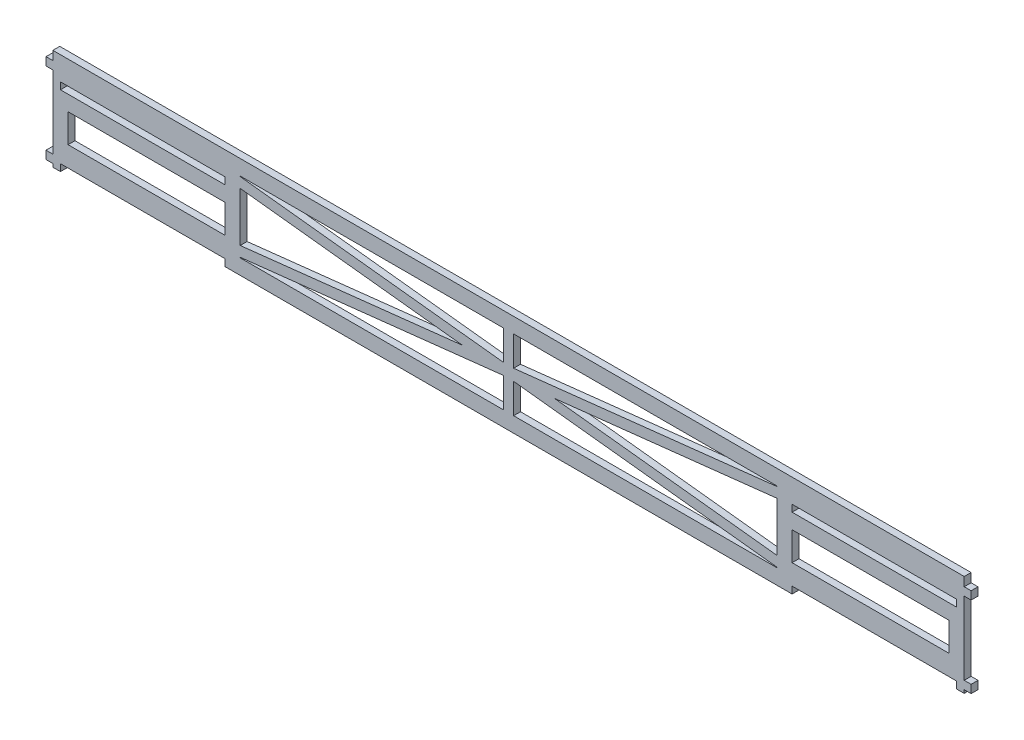
from build123d import *

# Parameters (mm, degrees)
SKETCH1_W           = 41.275
SKETCH1_H           = 1.7272
SKETCH1_W_2         = 39.37
SKETCH1_H_2         = 7.1628
BOSS_EXTRUDE1_DEPTH = 1.7272


with BuildPart() as part:
    # Sketch1 → Boss-Extrude1 (new body)
    with BuildSketch(Plane.XY):
        Polygon((-112.395, -12.7), (-114.3, -12.7), (-114.3, -11.8872), (-116.0272, -11.8872), (-116.0272, -9.8552), (-114.3, -9.8552), (-114.3, 8.4328), (-116.0272, 8.4328), (-116.0272, 10.4648), (-114.3, 10.4648), (-114.3, 12.7), (114.3, 12.7), (114.3, 10.4648), (116.0272, 10.4648), (116.0272, 8.4328), (114.3, 8.4328), (114.3, -9.8552), (116.0272, -9.8552), (116.0272, -11.8872), (114.3, -11.8872), (114.3, -12.7), (112.395, -12.7), (112.395, -10.9728), (71.12, -10.9728), (71.12, -12.7), (-71.12, -12.7), (-71.12, -10.9728), (-112.395, -10.9728), align=None)
        Polygon((67.31, -6.201073431), (11.500339125, 0), (67.31, 6.201073431), align=None, mode=Mode.SUBTRACT)
        Polygon((-67.31, 8.89), (-1.27, 8.89), (-1.27, 1.418926569), (-67.31, 8.756704347), align=None, mode=Mode.SUBTRACT)
        Polygon((-67.31, -8.89), (-1.27, -8.89), (-1.27, -1.418926569), (-67.31, -8.756704347), align=None, mode=Mode.SUBTRACT)
        Polygon((67.31, 8.89), (67.31, 8.756704347), (1.27, 1.418926569), (1.27, 8.89), align=None, mode=Mode.SUBTRACT)
        Polygon((67.31, -8.756704347), (1.27, -1.418926569), (1.27, -8.89), (67.31, -8.89), align=None, mode=Mode.SUBTRACT)
        Polygon((-67.31, 6.201073431), (-67.31, -6.201073431), (-11.500339125, 0), align=None, mode=Mode.SUBTRACT)
        with Locations((-91.7575, 5.9436)):
            Rectangle(SKETCH1_W, SKETCH1_H, mode=Mode.SUBTRACT)
        with Locations((91.7575, 5.9436)):
            Rectangle(SKETCH1_W, SKETCH1_H, mode=Mode.SUBTRACT)
        with Locations((90.805, -2.3114)):
            Rectangle(SKETCH1_W_2, SKETCH1_H_2, mode=Mode.SUBTRACT)
        with Locations((-90.805, -2.3114)):
            Rectangle(SKETCH1_W_2, SKETCH1_H_2, mode=Mode.SUBTRACT)
    extrude(amount=BOSS_EXTRUDE1_DEPTH)


solid = part.part
